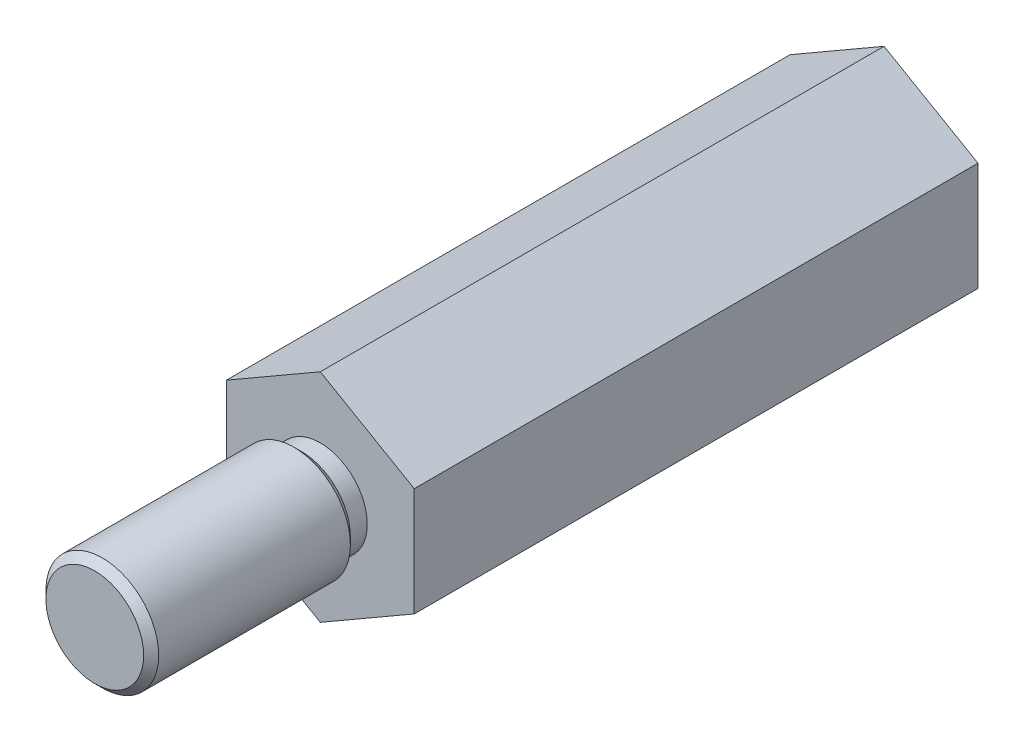
from build123d import *

# Parameters (mm, degrees)
EXTRUDE_1_DEPTH                = 15
SKETCH_2_R                     = 1.5
EXTRUDE_2_DEPTH                = 6
SKETCH_3_R                     = 1.5
SKETCH_3_R_2                   = 1.25
CUT_EXTRUDE_3_DEPTH            = 0.5
CHAMFER_1_SIZE                 = 0.2
M4_CLEARANCE_HOLE1_D           = 2.5
M4_CLEARANCE_HOLE1_DEPTH       = 6
M4_CLEARANCE_HOLE1_CSINK_D     = 3
M4_CLEARANCE_HOLE1_CSINK_ANGLE = 90
M4_CLEARANCE_HOLE1_TIP         = 0.751075774


with BuildPart() as part:
    # Эскиз1 → Вытянуть1 (new body)
    with BuildSketch(Plane.XY):
        Polygon((0, 2.886751346), (-2.5, 1.443375673), (-2.5, -1.443375673), (0, -2.886751346), (2.5, -1.443375673), (2.5, 1.443375673), align=None)
    extrude(amount=EXTRUDE_1_DEPTH)

    # Эскиз2 → Вытянуть2 (add)
    with BuildSketch(Plane.XY.offset(15)):
        Circle(SKETCH_2_R)
    extrude(amount=EXTRUDE_2_DEPTH)

    # Эскиз3 → Вырез-Вытянуть3 (cut)
    with BuildSketch(Plane.XY.offset(15)):
        Circle(SKETCH_3_R)
        Circle(SKETCH_3_R_2, mode=Mode.SUBTRACT)
    extrude(amount=CUT_EXTRUDE_3_DEPTH, mode=Mode.SUBTRACT)

    # Фаска1
    chamfer_1_edges = [part.edges().sort_by_distance(p)[0] for p in [
        (-1.5, 0, 21),
        (-1.5, 0, 15.5),
    ]]
    chamfer(chamfer_1_edges, length=CHAMFER_1_SIZE)

    # M4 Clearance Hole1
    with Locations(Plane(origin=(0, 0, 0), x_dir=(-1, 0, 0), z_dir=(0, 0, -1))):
        with Locations((0, 0)):
            CounterSinkHole(M4_CLEARANCE_HOLE1_D / 2, M4_CLEARANCE_HOLE1_CSINK_D / 2, depth=M4_CLEARANCE_HOLE1_DEPTH, counter_sink_angle=M4_CLEARANCE_HOLE1_CSINK_ANGLE)
            with Locations((0, 0, -(M4_CLEARANCE_HOLE1_DEPTH + M4_CLEARANCE_HOLE1_TIP / 2))):  # 118° drill point
                Cone(0, M4_CLEARANCE_HOLE1_D / 2, M4_CLEARANCE_HOLE1_TIP, mode=Mode.SUBTRACT)


solid = part.part
